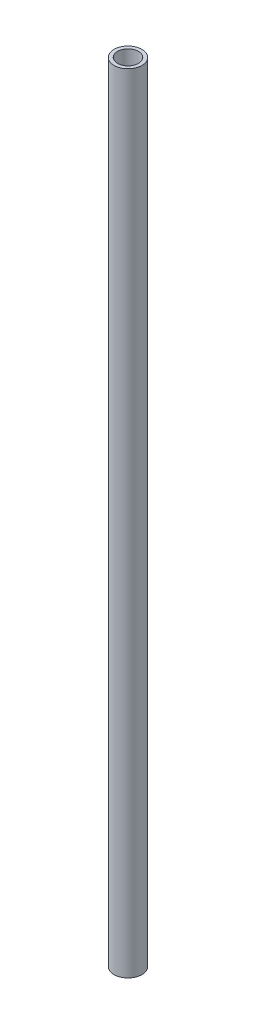
from build123d import *

# Parameters (mm, degrees)
SKETCH_1_R      = 4
SKETCH_1_R_2    = 3
EXTRUDE_1_DEPTH = 226


with BuildPart() as part:
    # 草图1 → 凸台-拉伸1 (new body)
    with BuildSketch(Plane(origin=(0, 0, 0), x_dir=(1, 0, 0), z_dir=(0, 1, 0))):
        with Locations(Location((0, 0, 0), (0, 0, 270))):
            Circle(SKETCH_1_R)
        with Locations(Location((0, 0, 0), (0, 0, 270))):
            Circle(SKETCH_1_R_2, mode=Mode.SUBTRACT)
    extrude(amount=EXTRUDE_1_DEPTH)


solid = part.part
